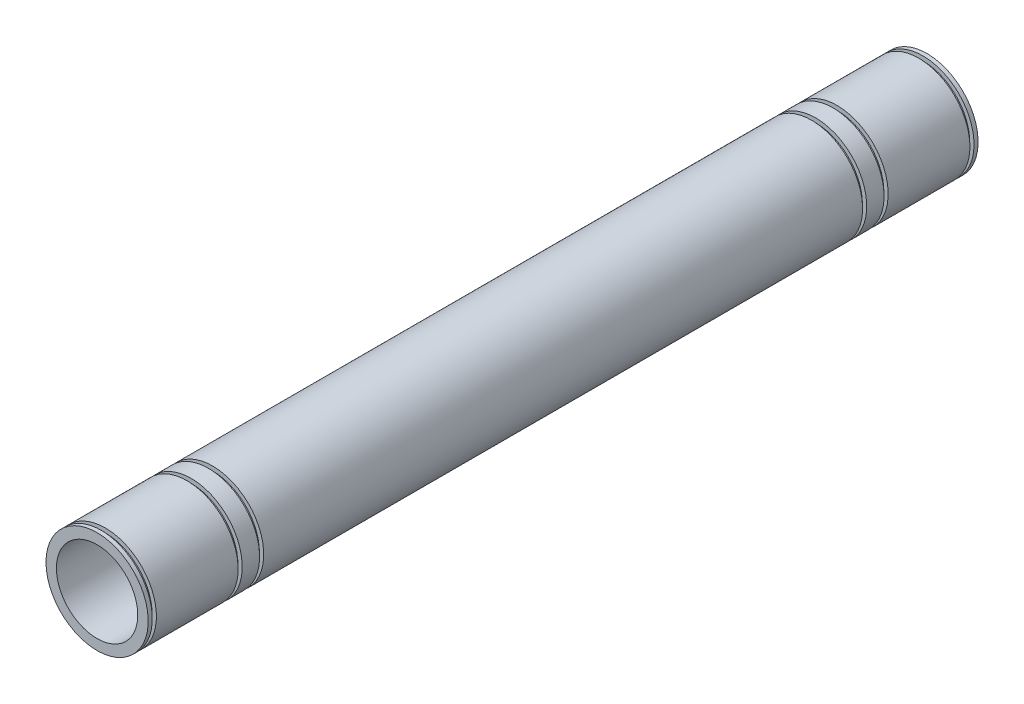
from build123d import *

# Parameters (mm, degrees)
SKETCH1_R   = 25
SKETCH1_R_2 = 19.9
BODY_DEPTH  = 406
SKETCH2_W   = 2
SKETCH2_H   = 2.1


with BuildPart() as part:
    # Sketch1 → Body (new body)
    with BuildSketch(Plane.XY):
        with Locations(Location((0, 0, 0), (0, 0, 180))):
            Circle(SKETCH1_R)
        with Locations(Location((0, 0, 0), (0, 0, 180))):
            Circle(SKETCH1_R_2, mode=Mode.SUBTRACT)
    extrude(amount=BODY_DEPTH)

    # Sketch2 → Ret Ring Grooves (revolve, cut)
    with BuildSketch(Plane(origin=(0, 0, 0), x_dir=(0, 0, -1), z_dir=(1, 0, 0)), mode=Mode.PRIVATE) as ret_ring_grooves_sk:
        with Locations((-403, 23.95)):
            Rectangle(SKETCH2_W, SKETCH2_H)
        with Locations((-361, 23.95)):
            Rectangle(SKETCH2_W, SKETCH2_H)
        with Locations((-55.5, 23.95)):
            Rectangle(SKETCH2_W, SKETCH2_H)
        with Locations((-350.5, 23.95)):
            Rectangle(SKETCH2_W, SKETCH2_H)
        with Locations((-45, 23.95)):
            Rectangle(SKETCH2_W, SKETCH2_H)
        with Locations((-3, 23.95)):
            Rectangle(SKETCH2_W, SKETCH2_H)
    revolve(ret_ring_grooves_sk.sketch.rotate(Axis((0, 0, 0), (0, 0, 1)), 90), axis=Axis((0, 0, 0), (0, 0, 1)), mode=Mode.SUBTRACT)


solid = part.part
